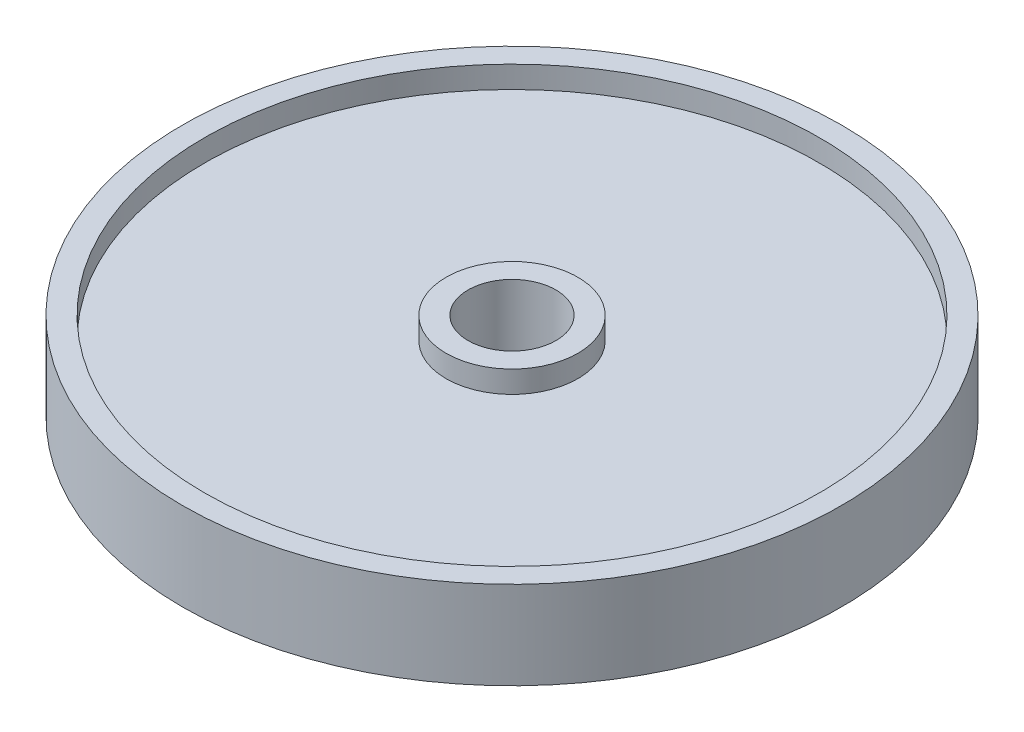
from build123d import *

# Parameters (mm, degrees)
SKETCH1_R           = 35
SKETCH1_R_2         = 7.5
BOSS_EXTRUDE1_DEPTH = 2.5
SKETCH1_3_R         = 37.5
SKETCH1_3_R_2       = 35
SKETCH1_3_R_3       = 7.5
SKETCH1_3_R_4       = 5
BOSS_EXTRUDE2_DEPTH = 5


with BuildPart() as part:
    # Sketch1 → Boss-Extrude1 (new, symmetric)
    with BuildSketch(Plane(origin=(0, 0, 0), x_dir=(1, 0, 0), z_dir=(0, 1, 0))):
        Circle(SKETCH1_R)
        Circle(SKETCH1_R_2, mode=Mode.SUBTRACT)
    extrude(amount=BOSS_EXTRUDE1_DEPTH, both=True)

    # Sketch1<3> → Boss-Extrude2 (add, symmetric)
    # profile 1 of 2: a face of its own
    with BuildSketch(Plane(origin=(0, 0, 0), x_dir=(1, 0, 0), z_dir=(0, 1, 0))):
        Circle(SKETCH1_3_R)
        Circle(SKETCH1_3_R_2, mode=Mode.SUBTRACT)
    # profile 2 of 2: a face of its own
    with BuildSketch(Plane(origin=(0, 0, 0), x_dir=(1, 0, 0), z_dir=(0, 1, 0))):
        Circle(SKETCH1_3_R_3)
        Circle(SKETCH1_3_R_4, mode=Mode.SUBTRACT)
    extrude(amount=BOSS_EXTRUDE2_DEPTH, both=True)


solid = part.part
